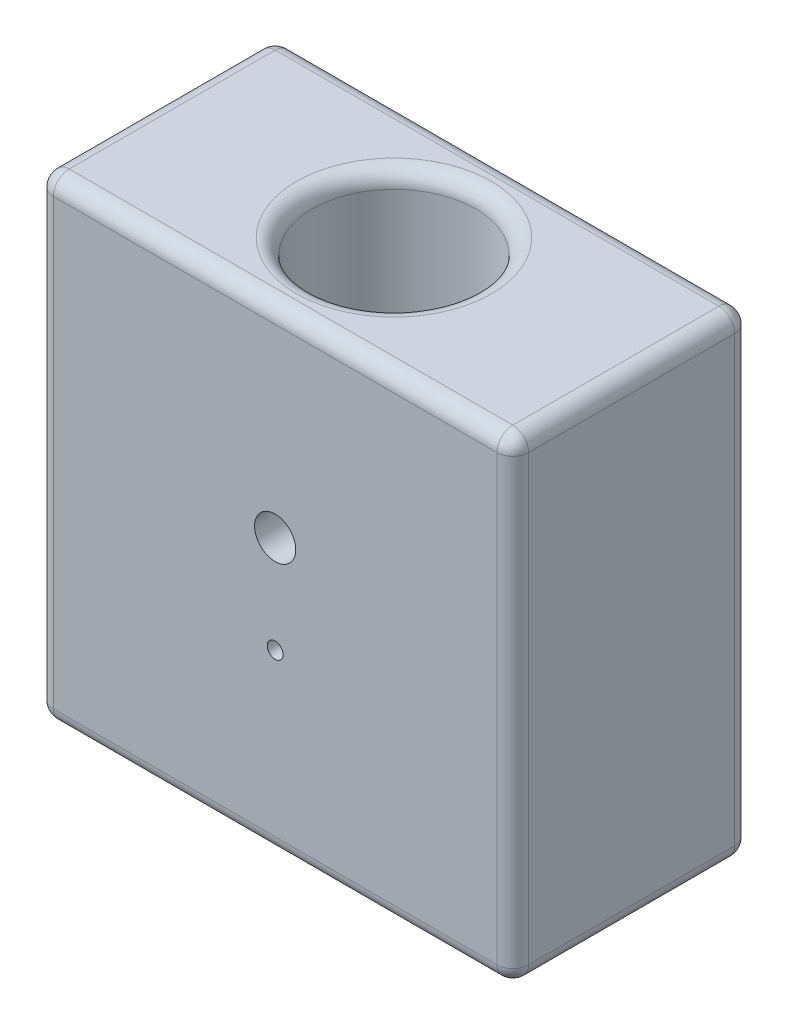
from build123d import *

# Parameters (mm, degrees)
SKETCH1_W           = 38.1
SKETCH1_H           = 19.05
BOSS_EXTRUDE1_DEPTH = 12.7
SKETCH2_W           = 38.1
SKETCH2_H           = 19.05
SKETCH2_R           = 6.5405
BOSS_EXTRUDE2_DEPTH = 25.4
SKETCH2_3_R         = 5.461
BOSS_EXTRUDE3_DEPTH = 15.24
SKETCH3_R           = 0.635
SKETCH3_R_2         = 1.651
CUT_EXTRUDE1_DEPTH  = 47.6627796
BOSS_EXTRUDE4_START = 6.35
SKETCH4_R           = 0.635
SKETCH4_R_2         = 1.651
BOSS_EXTRUDE4_DEPTH = 6.35
FILLET3_R           = 1.27
FILLET4_R           = 1.27
CHAMFER1_SIZE       = 0.381
CHAMFER2_SIZE       = 0.508


with BuildPart() as part:
    # Sketch1 → Boss-Extrude1 (new body)
    with BuildSketch(Plane(origin=(0, 0, 0), x_dir=(1, 0, 0), z_dir=(0, 1, 0))):
        Rectangle(SKETCH1_W, SKETCH1_H)
    extrude(amount=BOSS_EXTRUDE1_DEPTH)

    # Sketch2 → Boss-Extrude2 (add)
    # profile 1 of 4: a face of its own
    with BuildSketch(Plane(origin=(0, 12.7, 0), x_dir=(1, 0, 0), z_dir=(0, 1, 0))):
        Rectangle(SKETCH2_W, SKETCH2_H)
        with Locations(Location((0, 0, 0), (0, 0, 270))):
            Circle(SKETCH2_R, mode=Mode.SUBTRACT)
    # profile 2 of 4: a face of its own
    with BuildSketch(Plane(origin=(0, 12.7, 0), x_dir=(1, 0, 0), z_dir=(0, 1, 0))):
        Rectangle(SKETCH2_W, SKETCH2_H)
        with Locations(Location((0, 0, 0), (0, 0, 270))):
            Circle(SKETCH2_R, mode=Mode.SUBTRACT)
    # profile 3 of 4: a face of its own
    with BuildSketch(Plane(origin=(0, 12.7, 0), x_dir=(1, 0, 0), z_dir=(0, 1, 0))):
        Rectangle(SKETCH2_W, SKETCH2_H)
        with Locations(Location((0, 0, 0), (0, 0, 270))):
            Circle(SKETCH2_R, mode=Mode.SUBTRACT)
    # profile 4 of 4: a face of its own
    with BuildSketch(Plane(origin=(0, 12.7, 0), x_dir=(1, 0, 0), z_dir=(0, 1, 0))):
        Rectangle(SKETCH2_W, SKETCH2_H)
        with Locations(Location((0, 0, 0), (0, 0, 270))):
            Circle(SKETCH2_R, mode=Mode.SUBTRACT)
    extrude(amount=BOSS_EXTRUDE2_DEPTH)

    # Sketch2<3> → Boss-Extrude3 (add)
    with BuildSketch(Plane(origin=(0, 12.7, 0), x_dir=(1, 0, 0), z_dir=(0, 1, 0))):
        with Locations(Location((0, 0, 0), (0, 0, 90))):
            Circle(SKETCH2_3_R)
    extrude(amount=BOSS_EXTRUDE3_DEPTH)

    # Sketch3 → Cut-Extrude1 (cut, through all)
    with BuildSketch(Plane(origin=(0, 0, -9.525), x_dir=(-1, 0, 0), z_dir=(0, 0, -1))):
        with Locations((0, 14.224)):
            Circle(SKETCH3_R)
        with Locations((0, 22.0218)):
            Circle(SKETCH3_R_2)
    extrude(amount=-CUT_EXTRUDE1_DEPTH, mode=Mode.SUBTRACT)

    # Sketch4 → Boss-Extrude4 (add)
    with BuildSketch(Plane(origin=(0, 0, -9.525), x_dir=(-1, 0, 0), z_dir=(0, 0, -1)).offset(BOSS_EXTRUDE4_START)):
        with BuildLine():
            Line((5.08, 0), (5.08, 22.0218))
            ThreePointArc((5.08, 22.0218), (0, 27.1018), (-5.08, 22.0218))
            Line((-5.08, 22.0218), (-5.08, 0))
            Line((-5.08, 0), (5.08, 0))
        make_face()
        with Locations((0, 14.224)):
            Circle(SKETCH4_R, mode=Mode.SUBTRACT)
        with Locations((0, 22.0218)):
            Circle(SKETCH4_R_2, mode=Mode.SUBTRACT)
    extrude(amount=-BOSS_EXTRUDE4_DEPTH)

    # Fillet3
    fillet3_edges = [part.edges().sort_by_distance(p)[0] for p in [
        (0, 38.1, -6.5405),
        (0, 38.1, 9.525),
        (19.05, 38.1, 0),
        (0, 38.1, -9.525),
        (-19.05, 38.1, 0),
        (0, 0, 9.525),
        (-19.05, 0, 0),
        (-12.065, 0, -9.525),
        (12.065, 0, -9.525),
        (-5.08, 11.0109, -15.875),
        (-5.08, 0, -12.7),
        (0, 27.1018, -9.525),
        (5.08, 11.0109, -9.525),
        (5.08, 0, -12.7),
        (0, 27.1018, -15.875),
        (5.08, 11.0109, -15.875),
        (19.05, 0, 0),
        (0, 0, -15.875),
        (-5.08, 11.0109, -9.525),
        (19.05, 19.05, 9.525),
        (-19.05, 19.05, 9.525),
        (-19.05, 19.05, -9.525),
        (19.05, 19.05, -9.525),
    ]]
    fillet(fillet3_edges, radius=FILLET3_R)

    # Fillet4
    fillet4_edges = [part.edges().sort_by_distance(p)[0] for p in [
        (0, 27.94, 5.461),
    ]]
    fillet(fillet4_edges, radius=FILLET4_R)

    # Chamfer1
    chamfer1_edges = [part.edges().sort_by_distance(p)[0] for p in [
        (0.635, 14.224, -15.875),
    ]]
    chamfer(chamfer1_edges, length=CHAMFER1_SIZE)

    # Chamfer2
    chamfer2_edges = [part.edges().sort_by_distance(p)[0] for p in [
        (1.651, 22.0218, -15.875),
    ]]
    chamfer(chamfer2_edges, length=CHAMFER2_SIZE)


solid = part.part
